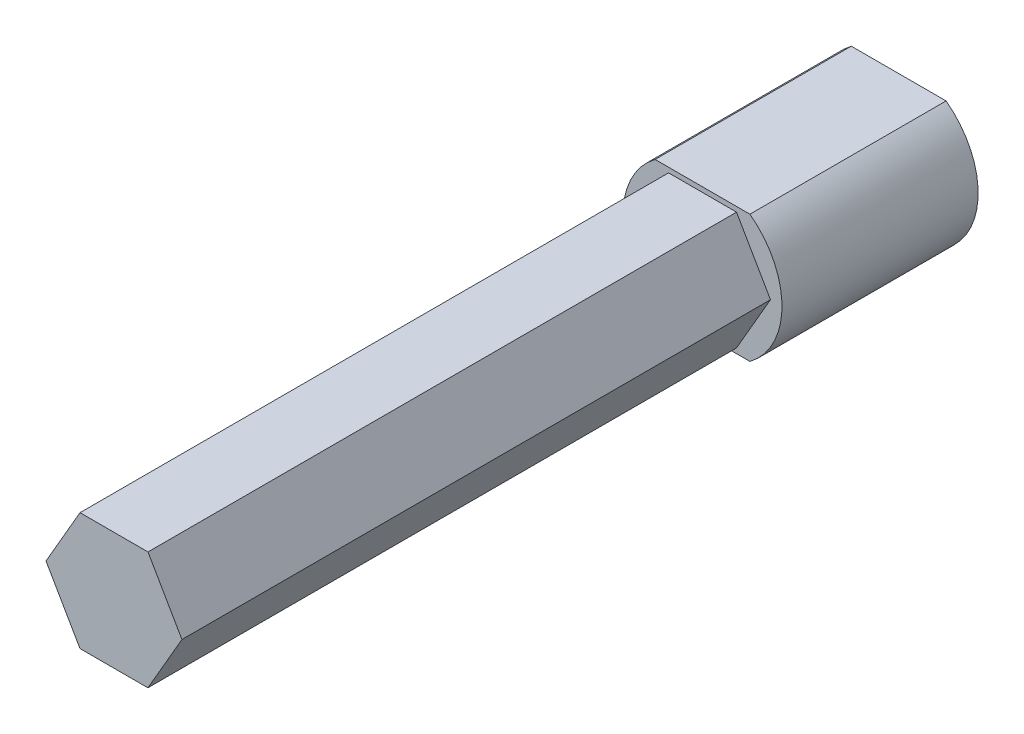
from build123d import *

# Parameters (mm, degrees)
BOSS_EXTRUDE2_DEPTH = 10
BOSS_EXTRUDE3_DEPTH = 30
CUT_EXTRUDE1_DEPTH  = 5


with BuildPart() as part:
    # Sketch1 → Boss-Extrude2 (new body)
    with BuildSketch(Plane.XY):
        with BuildLine():
            Line((-2.416609195, 3.25), (2.416609195, 3.25))
            ThreePointArc((2.416609195, 3.25), (4.05, 0), (2.416609195, -3.25))
            Line((2.416609195, -3.25), (-2.416609195, -3.25))
            ThreePointArc((-2.416609195, -3.25), (-4.05, 0), (-2.416609195, 3.25))
        make_face()
    extrude(amount=BOSS_EXTRUDE2_DEPTH)

    # Sketch4 → Boss-Extrude3 (add)
    with BuildSketch(Plane.XY.offset(10)):
        Polygon((1.730250139, -3.001038896), (3.464100991, -0.002078873), (1.733850853, 2.998960023), (-1.730250139, 3.001038896), (-3.464100991, 0.002078873), (-1.733850853, -2.998960023), align=None)
    extrude(amount=BOSS_EXTRUDE3_DEPTH)

    # Sketch3 → Cut-Extrude1 (cut)
    with BuildSketch(Plane(origin=(0, 0, 0), x_dir=(-1, 0, 0), z_dir=(0, 0, -1))):
        with BuildLine():
            Line((2.209072203, 2.65), (-2.209072203, 2.65))
            ThreePointArc((-2.209072203, 2.65), (-3.45, 0), (-2.209072203, -2.65))
            Line((-2.209072203, -2.65), (2.209072203, -2.65))
            ThreePointArc((2.209072203, -2.65), (3.45, 0), (2.209072203, 2.65))
        make_face()
    extrude(amount=-CUT_EXTRUDE1_DEPTH, mode=Mode.SUBTRACT)


solid = part.part
